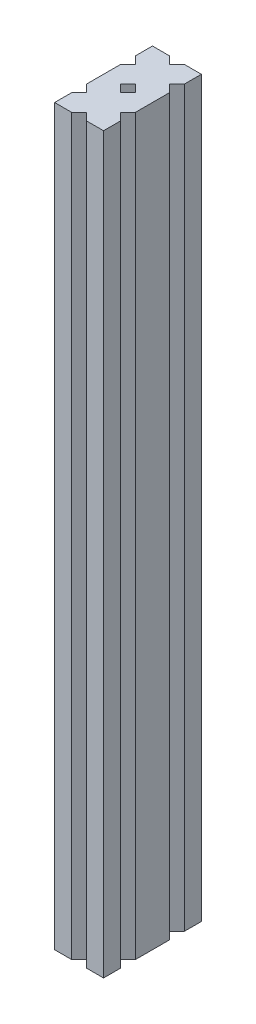
from build123d import *

# Parameters (mm, degrees)
SKIZZE1_W                       = 20
SKIZZE1_H                       = 40
AUFSATZ_LINEAR_AUSTRAGEN1_DEPTH = 300
SCHNITT_LINEAR_AUSTRAGEN1_DEPTH = 304.315017762


with BuildPart() as part:
    # Skizze1 → Aufsatz-Linear austragen1 (new body)
    with BuildSketch(Plane(origin=(0, 0, 0), x_dir=(1, 0, 0), z_dir=(0, 1, 0))):
        with Locations((10, 20)):
            Rectangle(SKIZZE1_W, SKIZZE1_H)
    extrude(amount=AUFSATZ_LINEAR_AUSTRAGEN1_DEPTH)

    # Skizze2 → Schnitt-Linear austragen1 (cut, through all)
    with BuildSketch(Plane(origin=(0, 300, 0), x_dir=(1, 0, 0), z_dir=(0, 1, 0))):
        Polygon((3, 30), (0, 33), (0, 27), align=None)
        Polygon((13, 40), (7, 40), (10, 37), align=None)
        Polygon((20, 27), (20, 33), (17, 30), align=None)
        Polygon((13, 20), (10, 17), (7, 20), align=None)
        Polygon((7, 20), (10, 23), (13, 20), align=None)
        Polygon((20, 7), (20, 13), (17, 10), align=None)
        Polygon((3, 10), (0, 13), (0, 7), align=None)
        Polygon((10, 3), (7, 0), (13, 0), align=None)
    extrude(amount=-SCHNITT_LINEAR_AUSTRAGEN1_DEPTH, mode=Mode.SUBTRACT)


solid = part.part
